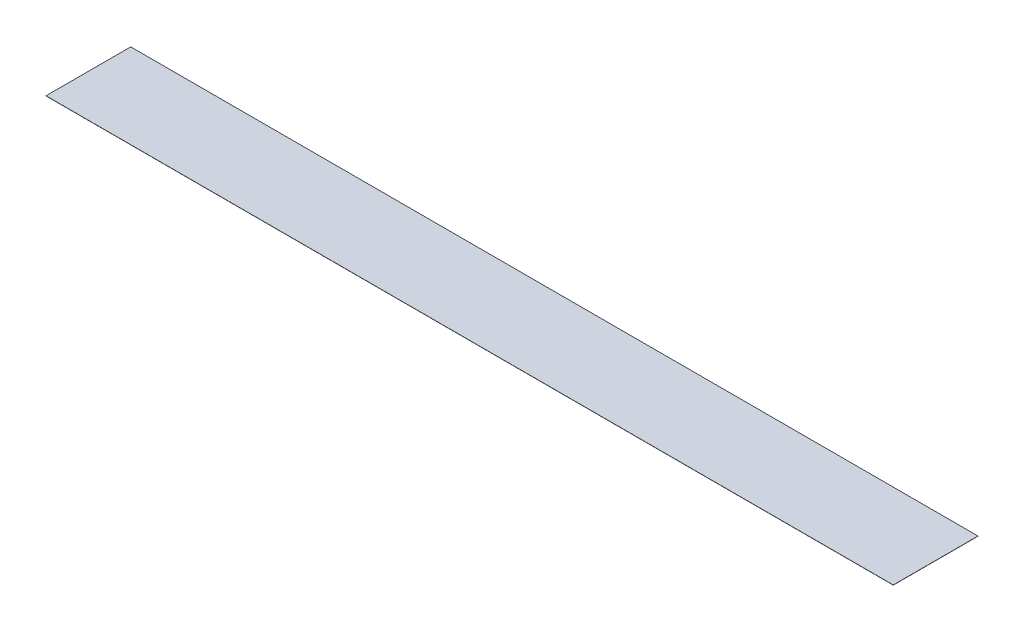
from build123d import *

# Parameters (mm, degrees)
SKETCH1_W           = 12700
SKETCH1_H           = 1270
BOSS_EXTRUDE1_DEPTH = 2.54


with BuildPart() as part:
    # Sketch1 → Boss-Extrude1 (new body)
    with BuildSketch(Plane(origin=(0, 0, 0), x_dir=(1, 0, 0), z_dir=(0, 1, 0))):
        Rectangle(SKETCH1_W, SKETCH1_H)
    extrude(amount=BOSS_EXTRUDE1_DEPTH)


solid = part.part
